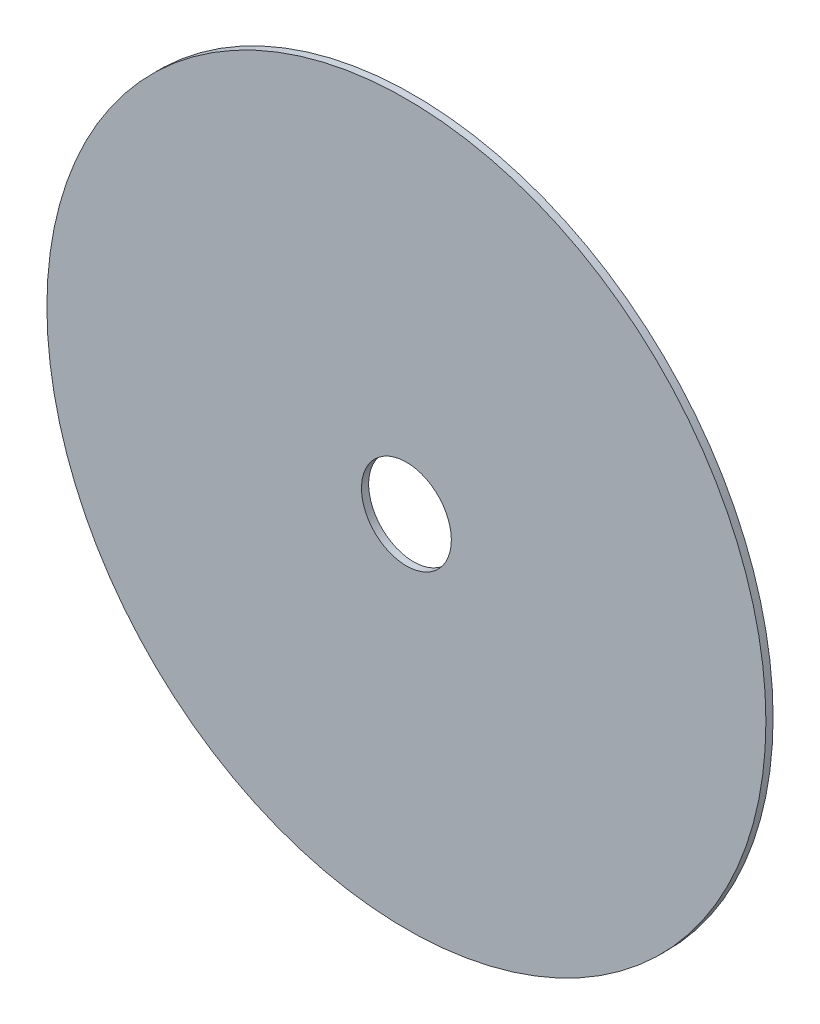
from build123d import *

# Parameters (mm, degrees)
ESQUISSE1_R        = 60
ESQUISSE1_R_2      = 58
ESQUISSE1_R_3      = 25
ESQUISSE1_R_4      = 23
ESQUISSE1_R_5      = 7.5
BOSS_EXTRU_1_DEPTH = 1.2


with BuildPart() as part:
    # Esquisse1 → Boss.-Extru.1 (new body)
    # profile 1 of 4: a face of its own
    with BuildSketch(Plane.XY):
        Circle(ESQUISSE1_R)
        Circle(ESQUISSE1_R_2, mode=Mode.SUBTRACT)
    # profile 2 of 4: a face of its own
    with BuildSketch(Plane.XY):
        Circle(ESQUISSE1_R_2)
        Circle(ESQUISSE1_R_3, mode=Mode.SUBTRACT)
    # profile 3 of 4: a face of its own
    with BuildSketch(Plane.XY):
        Circle(ESQUISSE1_R_3)
        Circle(ESQUISSE1_R_4, mode=Mode.SUBTRACT)
    # profile 4 of 4: a face of its own
    with BuildSketch(Plane.XY):
        Circle(ESQUISSE1_R_4)
        Circle(ESQUISSE1_R_5, mode=Mode.SUBTRACT)
    extrude(amount=BOSS_EXTRU_1_DEPTH)


solid = part.part
